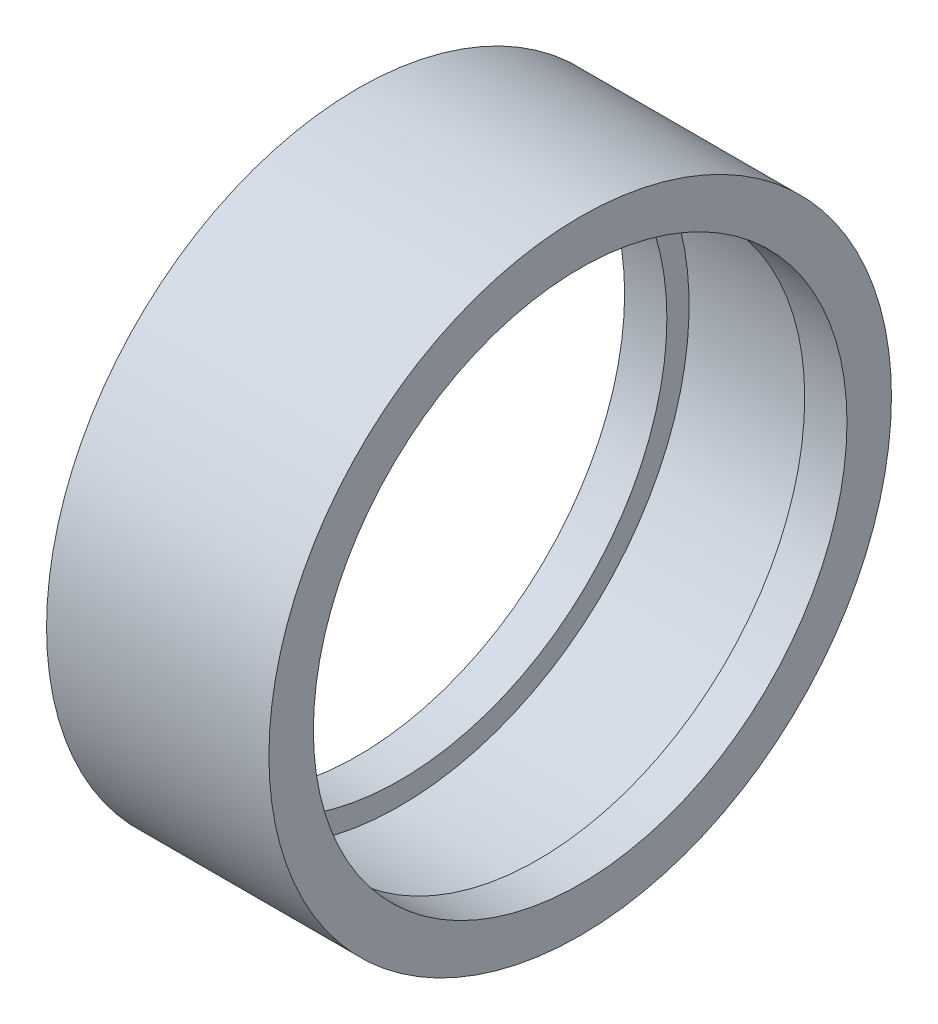
from build123d import *


with BuildPart() as part:
    # Sketch1 → Revolve1 (revolve)
    with BuildSketch(Plane.XY, mode=Mode.PRIVATE) as revolve1_sk:
        Polygon((92.835025381, 60), (102.335025381, 60), (102.335025381, 70), (52.335025381, 70), (52.335025381, 60), (61.835025381, 60), (61.835025381, 65), (92.835025381, 65), align=None)
    revolve(revolve1_sk.sketch.rotate(Axis((-182.741116751, 0, 0), (1, 0, 0)), 90), axis=Axis((-182.741116751, 0, 0), (1, 0, 0)))


solid = part.part
